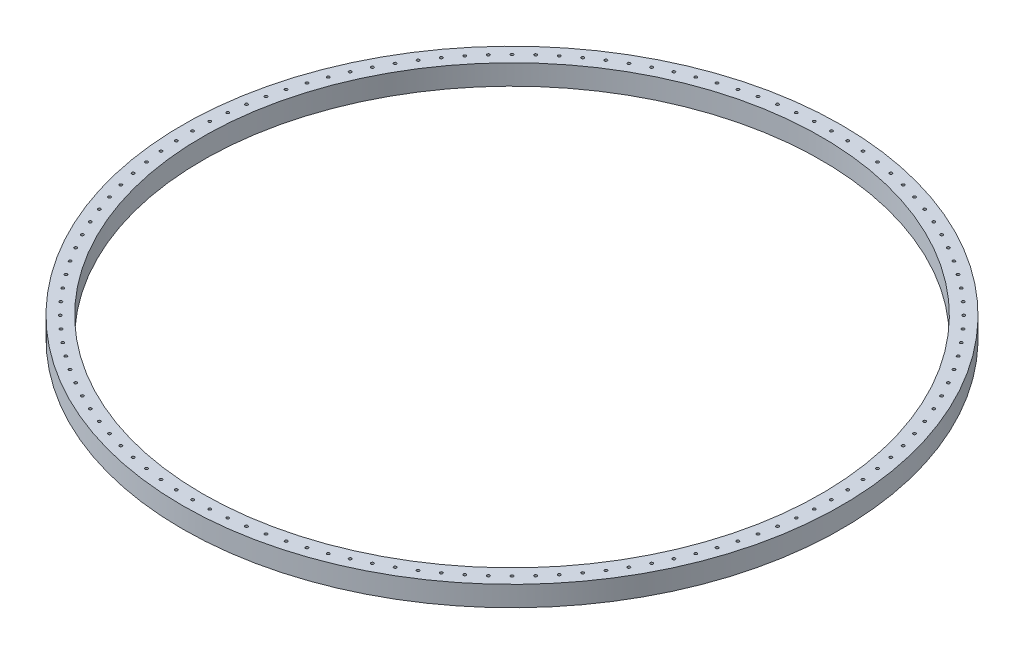
from build123d import *

# Parameters (mm, degrees)
SKETCH2_R           = 812.527
SKETCH2_R_2         = 3.4417
SKETCH2_R_3         = 762.527
BOSS_EXTRUDE1_DEPTH = 50


with BuildPart() as part:
    # Sketch2 → Boss-Extrude1 (new body)
    with BuildSketch(Plane(origin=(0, 0, 0), x_dir=(1, 0, 0), z_dir=(0, 1, 0))):
        with Locations(Location((0, 0, 0), (0, 0, 270))):
            Circle(SKETCH2_R)
        with Locations(Location((-428.917945328, -660.475716362, 0), (0, 0, 270))):
            Circle(SKETCH2_R_2, mode=Mode.SUBTRACT)
        with Locations(Location((-462.896756382, -637.122726529, 0), (0, 0, 270))):
            Circle(SKETCH2_R_2, mode=Mode.SUBTRACT)
        with Locations(Location((-495.606799602, -612.023427588, 0), (0, 0, 270))):
            Circle(SKETCH2_R_2, mode=Mode.SUBTRACT)
        with Locations(Location((-612.023427588, -495.606799602, 0), (0, 0, 270))):
            Circle(SKETCH2_R_2, mode=Mode.SUBTRACT)
        with Locations(Location((-637.122726529, -462.896756382, 0), (0, 0, 270))):
            Circle(SKETCH2_R_2, mode=Mode.SUBTRACT)
        with Locations(Location((-660.475716362, -428.917945328, 0), (0, 0, 270))):
            Circle(SKETCH2_R_2, mode=Mode.SUBTRACT)
        with Locations(Location((-526.958419034, -585.246614974, 0), (0, 0, 270))):
            Circle(SKETCH2_R_2, mode=Mode.SUBTRACT)
        with Locations(Location((-585.246614974, -526.958419034, 0), (0, 0, 270))):
            Circle(SKETCH2_R_2, mode=Mode.SUBTRACT)
        with Locations(Location((-556.865682067, -556.865682068, 0), (0, 0, 270))):
            Circle(SKETCH2_R_2, mode=Mode.SUBTRACT)
        with Locations(Location((-320.316088311, -719.441713621, 0), (0, 0, 270))):
            Circle(SKETCH2_R_2, mode=Mode.SUBTRACT)
        with Locations(Location((-282.224436201, -735.219792538, 0), (0, 0, 270))):
            Circle(SKETCH2_R_2, mode=Mode.SUBTRACT)
        with Locations(Location((-243.359226529, -748.982685108, 0), (0, 0, 270))):
            Circle(SKETCH2_R_2, mode=Mode.SUBTRACT)
        with Locations(Location((-203.826986132, -760.6926682, 0), (0, 0, 270))):
            Circle(SKETCH2_R_2, mode=Mode.SUBTRACT)
        with Locations(Location((-357.529776288, -701.691694975, 0), (0, 0, 270))):
            Circle(SKETCH2_R_2, mode=Mode.SUBTRACT)
        with Locations(Location((-393.7635, -682.018388166, 0), (0, 0, 270))):
            Circle(SKETCH2_R_2, mode=Mode.SUBTRACT)
        with Locations(Location((-163.736070135, -770.317645563, 0), (0, 0, 270))):
            Circle(SKETCH2_R_2, mode=Mode.SUBTRACT)
        with Locations(Location((-123.19636495, -777.831235804, 0), (0, 0, 270))):
            Circle(SKETCH2_R_2, mode=Mode.SUBTRACT)
        with Locations(Location((-82.318987092, -783.212844694, 0), (0, 0, 270))):
            Circle(SKETCH2_R_2, mode=Mode.SUBTRACT)
        with Locations(Location((-41.215978612, -786.447721617, 0), (0, 0, 270))):
            Circle(SKETCH2_R_2, mode=Mode.SUBTRACT)
        with Locations(Location((-719.441713621, -320.316088312, 0), (0, 0, 270))):
            Circle(SKETCH2_R_2, mode=Mode.SUBTRACT)
        with Locations(Location((-682.018388166, -393.7635, 0), (0, 0, 270))):
            Circle(SKETCH2_R_2, mode=Mode.SUBTRACT)
        with Locations(Location((-701.691694974, -357.529776288, 0), (0, 0, 270))):
            Circle(SKETCH2_R_2, mode=Mode.SUBTRACT)
        with Locations(Location((-735.219792538, -282.224436202, 0), (0, 0, 270))):
            Circle(SKETCH2_R_2, mode=Mode.SUBTRACT)
        with Locations(Location((-748.982685108, -243.359226529, 0), (0, 0, 270))):
            Circle(SKETCH2_R_2, mode=Mode.SUBTRACT)
        with Locations(Location((-760.6926682, -203.826986132, 0), (0, 0, 270))):
            Circle(SKETCH2_R_2, mode=Mode.SUBTRACT)
        with Locations(Location((-770.317645563, -163.736070135, 0), (0, 0, 270))):
            Circle(SKETCH2_R_2, mode=Mode.SUBTRACT)
        with Locations(Location((-777.831235804, -123.19636495, 0), (0, 0, 270))):
            Circle(SKETCH2_R_2, mode=Mode.SUBTRACT)
        with Locations(Location((-783.212844694, -82.318987092, 0), (0, 0, 270))):
            Circle(SKETCH2_R_2, mode=Mode.SUBTRACT)
        with Locations(Location((-786.447721617, -41.215978612, 0), (0, 0, 270))):
            Circle(SKETCH2_R_2, mode=Mode.SUBTRACT)
        with Locations(Location((-787.527, 0, 0), (0, 0, 270))):
            Circle(SKETCH2_R_2, mode=Mode.SUBTRACT)
        with Locations(Location((0, -787.527, 0), (0, 0, 270))):
            Circle(SKETCH2_R_2, mode=Mode.SUBTRACT)
        with Locations(Location((41.215978612, -786.447721617, 0), (0, 0, 270))):
            Circle(SKETCH2_R_2, mode=Mode.SUBTRACT)
        with Locations(Location((82.318987092, -783.212844694, 0), (0, 0, 270))):
            Circle(SKETCH2_R_2, mode=Mode.SUBTRACT)
        with Locations(Location((123.19636495, -777.831235804, 0), (0, 0, 270))):
            Circle(SKETCH2_R_2, mode=Mode.SUBTRACT)
        with Locations(Location((163.736070135, -770.317645563, 0), (0, 0, 270))):
            Circle(SKETCH2_R_2, mode=Mode.SUBTRACT)
        with Locations(Location((203.826986133, -760.6926682, 0), (0, 0, 270))):
            Circle(SKETCH2_R_2, mode=Mode.SUBTRACT)
        with Locations(Location((243.359226529, -748.982685108, 0), (0, 0, 270))):
            Circle(SKETCH2_R_2, mode=Mode.SUBTRACT)
        with Locations(Location((282.224436202, -735.219792538, 0), (0, 0, 270))):
            Circle(SKETCH2_R_2, mode=Mode.SUBTRACT)
        with Locations(Location((320.316088312, -719.441713621, 0), (0, 0, 270))):
            Circle(SKETCH2_R_2, mode=Mode.SUBTRACT)
        with Locations(Location((357.529776288, -701.691694974, 0), (0, 0, 270))):
            Circle(SKETCH2_R_2, mode=Mode.SUBTRACT)
        with Locations(Location((393.7635, -682.018388166, 0), (0, 0, 270))):
            Circle(SKETCH2_R_2, mode=Mode.SUBTRACT)
        with Locations(Location((428.917945328, -660.475716362, 0), (0, 0, 270))):
            Circle(SKETCH2_R_2, mode=Mode.SUBTRACT)
        with Locations(Location((462.896756382, -637.122726529, 0), (0, 0, 270))):
            Circle(SKETCH2_R_2, mode=Mode.SUBTRACT)
        with Locations(Location((495.606799602, -612.023427588, 0), (0, 0, 270))):
            Circle(SKETCH2_R_2, mode=Mode.SUBTRACT)
        with Locations(Location((526.958419034, -585.246614974, 0), (0, 0, 270))):
            Circle(SKETCH2_R_2, mode=Mode.SUBTRACT)
        with Locations(Location((556.865682068, -556.865682067, 0), (0, 0, 270))):
            Circle(SKETCH2_R_2, mode=Mode.SUBTRACT)
        with Locations(Location((585.246614974, -526.958419034, 0), (0, 0, 270))):
            Circle(SKETCH2_R_2, mode=Mode.SUBTRACT)
        with Locations(Location((612.023427588, -495.606799602, 0), (0, 0, 270))):
            Circle(SKETCH2_R_2, mode=Mode.SUBTRACT)
        with Locations(Location((637.122726529, -462.896756382, 0), (0, 0, 270))):
            Circle(SKETCH2_R_2, mode=Mode.SUBTRACT)
        with Locations(Location((660.475716362, -428.917945328, 0), (0, 0, 270))):
            Circle(SKETCH2_R_2, mode=Mode.SUBTRACT)
        with Locations(Location((682.018388166, -393.7635, 0), (0, 0, 270))):
            Circle(SKETCH2_R_2, mode=Mode.SUBTRACT)
        with Locations(Location((701.691694975, -357.529776288, 0), (0, 0, 270))):
            Circle(SKETCH2_R_2, mode=Mode.SUBTRACT)
        with Locations(Location((719.441713621, -320.316088312, 0), (0, 0, 270))):
            Circle(SKETCH2_R_2, mode=Mode.SUBTRACT)
        with Locations(Location((735.219792538, -282.224436202, 0), (0, 0, 270))):
            Circle(SKETCH2_R_2, mode=Mode.SUBTRACT)
        with Locations(Location((748.982685108, -243.359226529, 0), (0, 0, 270))):
            Circle(SKETCH2_R_2, mode=Mode.SUBTRACT)
        with Locations(Location((760.6926682, -203.826986132, 0), (0, 0, 270))):
            Circle(SKETCH2_R_2, mode=Mode.SUBTRACT)
        with Locations(Location((770.317645563, -163.736070135, 0), (0, 0, 270))):
            Circle(SKETCH2_R_2, mode=Mode.SUBTRACT)
        with Locations(Location((777.831235804, -123.19636495, 0), (0, 0, 270))):
            Circle(SKETCH2_R_2, mode=Mode.SUBTRACT)
        with Locations(Location((783.212844694, -82.318987092, 0), (0, 0, 270))):
            Circle(SKETCH2_R_2, mode=Mode.SUBTRACT)
        with Locations(Location((786.447721617, -41.215978612, 0), (0, 0, 270))):
            Circle(SKETCH2_R_2, mode=Mode.SUBTRACT)
        with Locations(Location((-786.447721617, 41.215978612, 0), (0, 0, 270))):
            Circle(SKETCH2_R_2, mode=Mode.SUBTRACT)
        with Locations(Location((-783.212844694, 82.318987092, 0), (0, 0, 270))):
            Circle(SKETCH2_R_2, mode=Mode.SUBTRACT)
        with Locations(Location((-777.831235804, 123.19636495, 0), (0, 0, 270))):
            Circle(SKETCH2_R_2, mode=Mode.SUBTRACT)
        with Locations(Location((-770.317645563, 163.736070135, 0), (0, 0, 270))):
            Circle(SKETCH2_R_2, mode=Mode.SUBTRACT)
        with Locations(Location((-760.6926682, 203.826986132, 0), (0, 0, 270))):
            Circle(SKETCH2_R_2, mode=Mode.SUBTRACT)
        with Locations(Location((-748.982685108, 243.359226529, 0), (0, 0, 270))):
            Circle(SKETCH2_R_2, mode=Mode.SUBTRACT)
        with Locations(Location((-735.219792538, 282.224436202, 0), (0, 0, 270))):
            Circle(SKETCH2_R_2, mode=Mode.SUBTRACT)
        with Locations(Location((-719.441713621, 320.316088312, 0), (0, 0, 270))):
            Circle(SKETCH2_R_2, mode=Mode.SUBTRACT)
        with Locations(Location((-701.691694974, 357.529776288, 0), (0, 0, 270))):
            Circle(SKETCH2_R_2, mode=Mode.SUBTRACT)
        with Locations(Location((-682.018388166, 393.7635, 0), (0, 0, 270))):
            Circle(SKETCH2_R_2, mode=Mode.SUBTRACT)
        with Locations(Location((-660.475716362, 428.917945328, 0), (0, 0, 270))):
            Circle(SKETCH2_R_2, mode=Mode.SUBTRACT)
        with Locations(Location((-637.122726529, 462.896756382, 0), (0, 0, 270))):
            Circle(SKETCH2_R_2, mode=Mode.SUBTRACT)
        with Locations(Location((-612.023427588, 495.606799602, 0), (0, 0, 270))):
            Circle(SKETCH2_R_2, mode=Mode.SUBTRACT)
        with Locations(Location((-585.246614974, 526.958419034, 0), (0, 0, 270))):
            Circle(SKETCH2_R_2, mode=Mode.SUBTRACT)
        with Locations(Location((-556.865682067, 556.865682067, 0), (0, 0, 270))):
            Circle(SKETCH2_R_2, mode=Mode.SUBTRACT)
        with Locations(Location((-526.958419034, 585.246614974, 0), (0, 0, 270))):
            Circle(SKETCH2_R_2, mode=Mode.SUBTRACT)
        with Locations(Location((-495.606799602, 612.023427588, 0), (0, 0, 270))):
            Circle(SKETCH2_R_2, mode=Mode.SUBTRACT)
        with Locations(Location((-462.896756382, 637.122726529, 0), (0, 0, 270))):
            Circle(SKETCH2_R_2, mode=Mode.SUBTRACT)
        with Locations(Location((-428.917945328, 660.475716362, 0), (0, 0, 270))):
            Circle(SKETCH2_R_2, mode=Mode.SUBTRACT)
        with Locations(Location((-393.7635, 682.018388166, 0), (0, 0, 270))):
            Circle(SKETCH2_R_2, mode=Mode.SUBTRACT)
        with Locations(Location((-357.529776288, 701.691694974, 0), (0, 0, 270))):
            Circle(SKETCH2_R_2, mode=Mode.SUBTRACT)
        with Locations(Location((-320.316088312, 719.441713621, 0), (0, 0, 270))):
            Circle(SKETCH2_R_2, mode=Mode.SUBTRACT)
        with Locations(Location((-282.224436202, 735.219792538, 0), (0, 0, 270))):
            Circle(SKETCH2_R_2, mode=Mode.SUBTRACT)
        with Locations(Location((-243.359226529, 748.982685108, 0), (0, 0, 270))):
            Circle(SKETCH2_R_2, mode=Mode.SUBTRACT)
        with Locations(Location((-203.826986132, 760.6926682, 0), (0, 0, 270))):
            Circle(SKETCH2_R_2, mode=Mode.SUBTRACT)
        with Locations(Location((-163.736070135, 770.317645563, 0), (0, 0, 270))):
            Circle(SKETCH2_R_2, mode=Mode.SUBTRACT)
        with Locations(Location((-123.19636495, 777.831235804, 0), (0, 0, 270))):
            Circle(SKETCH2_R_2, mode=Mode.SUBTRACT)
        with Locations(Location((-82.318987092, 783.212844694, 0), (0, 0, 270))):
            Circle(SKETCH2_R_2, mode=Mode.SUBTRACT)
        with Locations(Location((-41.215978612, 786.447721617, 0), (0, 0, 270))):
            Circle(SKETCH2_R_2, mode=Mode.SUBTRACT)
        with Locations(Location((0, 0, 0), (0, 0, 270))):
            Circle(SKETCH2_R_3, mode=Mode.SUBTRACT)
        with Locations(Location((787.527, 0, 0), (0, 0, 270))):
            Circle(SKETCH2_R_2, mode=Mode.SUBTRACT)
        with Locations(Location((786.447721617, 41.215978612, 0), (0, 0, 270))):
            Circle(SKETCH2_R_2, mode=Mode.SUBTRACT)
        with Locations(Location((783.212844694, 82.318987092, 0), (0, 0, 270))):
            Circle(SKETCH2_R_2, mode=Mode.SUBTRACT)
        with Locations(Location((777.831235804, 123.19636495, 0), (0, 0, 270))):
            Circle(SKETCH2_R_2, mode=Mode.SUBTRACT)
        with Locations(Location((770.317645563, 163.736070135, 0), (0, 0, 270))):
            Circle(SKETCH2_R_2, mode=Mode.SUBTRACT)
        with Locations(Location((760.6926682, 203.826986132, 0), (0, 0, 270))):
            Circle(SKETCH2_R_2, mode=Mode.SUBTRACT)
        with Locations(Location((748.982685108, 243.359226529, 0), (0, 0, 270))):
            Circle(SKETCH2_R_2, mode=Mode.SUBTRACT)
        with Locations(Location((735.219792538, 282.224436202, 0), (0, 0, 270))):
            Circle(SKETCH2_R_2, mode=Mode.SUBTRACT)
        with Locations(Location((701.691694975, 357.529776288, 0), (0, 0, 270))):
            Circle(SKETCH2_R_2, mode=Mode.SUBTRACT)
        with Locations(Location((682.018388166, 393.7635, 0), (0, 0, 270))):
            Circle(SKETCH2_R_2, mode=Mode.SUBTRACT)
        with Locations(Location((719.441713621, 320.316088312, 0), (0, 0, 270))):
            Circle(SKETCH2_R_2, mode=Mode.SUBTRACT)
        with Locations(Location((41.215978612, 786.447721617, 0), (0, 0, 270))):
            Circle(SKETCH2_R_2, mode=Mode.SUBTRACT)
        with Locations(Location((0, 787.527, 0), (0, 0, 270))):
            Circle(SKETCH2_R_2, mode=Mode.SUBTRACT)
        with Locations(Location((82.318987092, 783.212844694, 0), (0, 0, 270))):
            Circle(SKETCH2_R_2, mode=Mode.SUBTRACT)
        with Locations(Location((123.19636495, 777.831235804, 0), (0, 0, 270))):
            Circle(SKETCH2_R_2, mode=Mode.SUBTRACT)
        with Locations(Location((163.736070135, 770.317645563, 0), (0, 0, 270))):
            Circle(SKETCH2_R_2, mode=Mode.SUBTRACT)
        with Locations(Location((393.7635, 682.018388166, 0), (0, 0, 270))):
            Circle(SKETCH2_R_2, mode=Mode.SUBTRACT)
        with Locations(Location((357.529776288, 701.691694974, 0), (0, 0, 270))):
            Circle(SKETCH2_R_2, mode=Mode.SUBTRACT)
        with Locations(Location((203.826986132, 760.6926682, 0), (0, 0, 270))):
            Circle(SKETCH2_R_2, mode=Mode.SUBTRACT)
        with Locations(Location((243.359226529, 748.982685108, 0), (0, 0, 270))):
            Circle(SKETCH2_R_2, mode=Mode.SUBTRACT)
        with Locations(Location((282.224436202, 735.219792538, 0), (0, 0, 270))):
            Circle(SKETCH2_R_2, mode=Mode.SUBTRACT)
        with Locations(Location((320.316088312, 719.441713621, 0), (0, 0, 270))):
            Circle(SKETCH2_R_2, mode=Mode.SUBTRACT)
        with Locations(Location((556.865682068, 556.865682068, 0), (0, 0, 270))):
            Circle(SKETCH2_R_2, mode=Mode.SUBTRACT)
        with Locations(Location((585.246614974, 526.958419034, 0), (0, 0, 270))):
            Circle(SKETCH2_R_2, mode=Mode.SUBTRACT)
        with Locations(Location((526.958419034, 585.246614974, 0), (0, 0, 270))):
            Circle(SKETCH2_R_2, mode=Mode.SUBTRACT)
        with Locations(Location((660.475716362, 428.917945328, 0), (0, 0, 270))):
            Circle(SKETCH2_R_2, mode=Mode.SUBTRACT)
        with Locations(Location((637.122726529, 462.896756382, 0), (0, 0, 270))):
            Circle(SKETCH2_R_2, mode=Mode.SUBTRACT)
        with Locations(Location((612.023427588, 495.606799602, 0), (0, 0, 270))):
            Circle(SKETCH2_R_2, mode=Mode.SUBTRACT)
        with Locations(Location((495.606799602, 612.023427588, 0), (0, 0, 270))):
            Circle(SKETCH2_R_2, mode=Mode.SUBTRACT)
        with Locations(Location((462.896756382, 637.122726529, 0), (0, 0, 270))):
            Circle(SKETCH2_R_2, mode=Mode.SUBTRACT)
        with Locations(Location((428.917945328, 660.475716362, 0), (0, 0, 270))):
            Circle(SKETCH2_R_2, mode=Mode.SUBTRACT)
    extrude(amount=BOSS_EXTRUDE1_DEPTH)


solid = part.part
